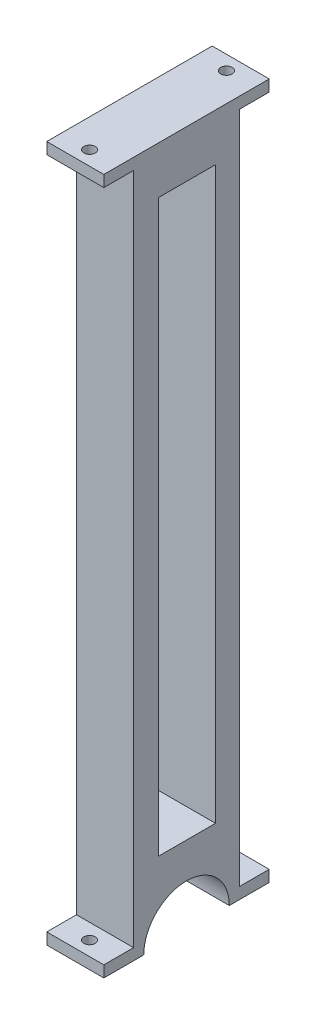
from build123d import *

# Parameters (mm, degrees)
BOSS_EXTRUDE3_DEPTH = 10
SKETCH8_W           = 10
SKETCH8_H           = 100
CUT_EXTRUDE1_DEPTH  = 10
SKETCH9_R           = 1
CUT_EXTRUDE2_DEPTH  = 2
SKETCH11_R          = 1
CUT_EXTRUDE3_DEPTH  = 2
LPATTERN1_COUNT     = 2
LPATTERN1_PITCH     = 120


with BuildPart() as part:
    # Sketch1 → Boss-Extrude3 (new body)
    with BuildSketch(Plane(origin=(0, 0, 0), x_dir=(0, 0, -1), z_dir=(1, 0, 0))):
        with BuildLine():
            Line((7.5, 0), (14.5, 0))
            Line((14.5, 0), (14.5, 2))
            Line((14.5, 2), (9.287087811, 2))
            Line((9.287087811, 2), (9.287087811, 120))
            Line((9.287087811, 120), (14.5, 120))
            Line((14.5, 120), (14.5, 122))
            Line((14.5, 122), (9.287087811, 122))
            Line((9.287087811, 122), (-9.287087811, 122))
            Line((-9.287087811, 122), (-14.5, 122))
            Line((-14.5, 122), (-14.5, 120))
            Line((-14.5, 120), (-9.287087811, 120))
            Line((-9.287087811, 120), (-9.287087811, 2))
            Line((-9.287087811, 2), (-14.5, 2))
            Line((-14.5, 2), (-14.5, 0))
            Line((-14.5, 0), (-7.5, 0))
            ThreePointArc((-7.5, 0), (0, 7.5), (7.5, 0))
        make_face()
    extrude(amount=BOSS_EXTRUDE3_DEPTH)

    # Sketch8 → Cut-Extrude1 (cut)
    with BuildSketch(Plane(origin=(10, 0, 0), x_dir=(0, 0, -1), z_dir=(1, 0, 0))):
        with Locations((0.077954642, 63.696555082)):
            Rectangle(SKETCH8_W, SKETCH8_H)
    extrude(amount=-CUT_EXTRUDE1_DEPTH, mode=Mode.SUBTRACT)

    # Sketch9 → Cut-Extrude2 (cut)
    with BuildSketch(Plane(origin=(0, 2, 0), x_dir=(1, 0, 0), z_dir=(0, 1, 0))):
        with Locations(Location((5, 12, 0), (0, 0, 270))):
            Circle(SKETCH9_R)
    cut_extrude2 = extrude(amount=-CUT_EXTRUDE2_DEPTH, mode=Mode.SUBTRACT)

    # Sketch11 → Cut-Extrude3 (cut)
    with BuildSketch(Plane(origin=(0, 2, 0), x_dir=(1, 0, 0), z_dir=(0, 1, 0))):
        with Locations(Location((5, -12, 0), (0, 0, 270))):
            Circle(SKETCH11_R)
    cut_extrude3 = extrude(amount=-CUT_EXTRUDE3_DEPTH, mode=Mode.SUBTRACT)

    # LPattern1: Cut-Extrude2, Cut-Extrude3 ×2
    with Locations(*[(0, i * LPATTERN1_PITCH, 0) for i in range(1, LPATTERN1_COUNT)]):
        add(cut_extrude2, mode=Mode.SUBTRACT)
        add(cut_extrude3, mode=Mode.SUBTRACT)


solid = part.part
